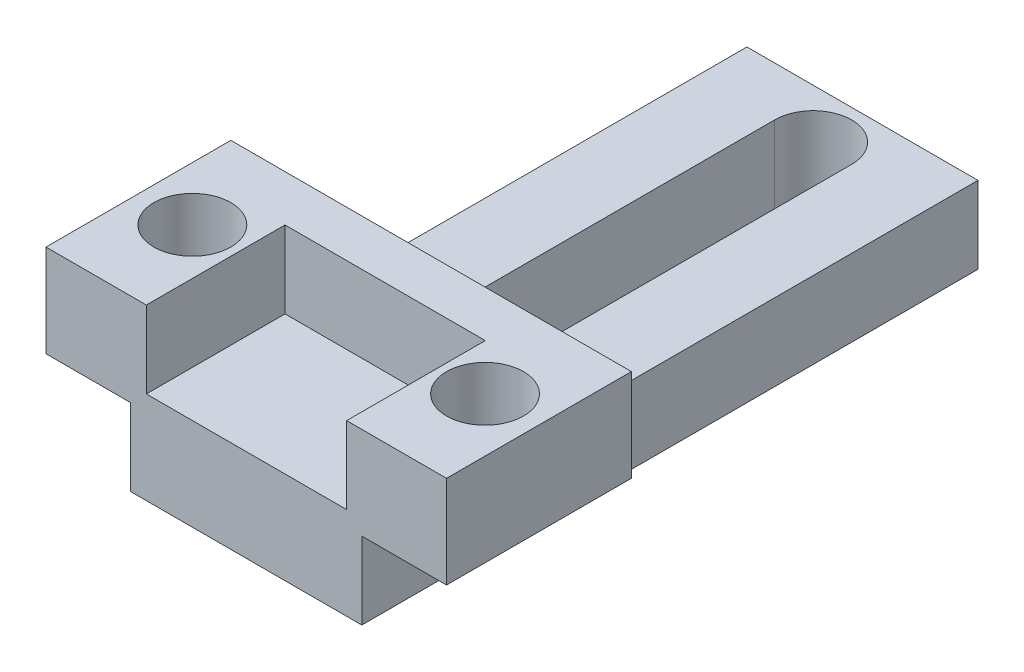
from build123d import *

# Parameters (mm, degrees)
SKETCH_1_W          = 15
SKETCH_1_H          = 40
EXTRUDE_1_DEPTH     = 5
SKETCH_2_W          = 26
SKETCH_2_H          = 12
SKETCH_2_R          = 2.5
EXTRUDE_2_DEPTH     = 6
SKETCH_3_W          = 13
SKETCH_3_H          = 9
CUT_EXTRUDE_1_DEPTH = 5


with BuildPart() as part:
    # 草圖1 → 填料-伸長1 (new body)
    with BuildSketch(Plane(origin=(0, 0, 0), x_dir=(1, 0, 0), z_dir=(0, 1, 0))):
        Rectangle(SKETCH_1_W, SKETCH_1_H)
        with BuildLine():
            Line((2.5, 16.799309419), (2.5, -11.700690581))
            ThreePointArc((2.5, -11.700690581), (0, -14.200690581), (-2.5, -11.700690581))
            Line((-2.5, -11.700690581), (-2.5, 16.799309419))
            ThreePointArc((-2.5, 16.799309419), (0, 19.299309419), (2.5, 16.799309419))
        make_face(mode=Mode.SUBTRACT)
    extrude(amount=EXTRUDE_1_DEPTH)

    # 草圖2 → 填料-伸長2 (add)
    with BuildSketch(Plane(origin=(0, 5, 0), x_dir=(1, 0, 0), z_dir=(0, 1, 0))):
        with Locations((0, -14)):
            Rectangle(SKETCH_2_W, SKETCH_2_H)
        with Locations(Location((-9.5, -14, 0), (0, 0, 36.869897646))):
            Circle(SKETCH_2_R, mode=Mode.SUBTRACT)
        with Locations(Location((9.5, -14, 0), (0, 0, 90))):
            Circle(SKETCH_2_R, mode=Mode.SUBTRACT)
    extrude(amount=EXTRUDE_2_DEPTH)

    # 草圖3 → 除料-伸長1 (cut)
    with BuildSketch(Plane(origin=(0, 11, 0), x_dir=(1, 0, 0), z_dir=(0, 1, 0))):
        with Locations((0.015491802, -15.5)):
            Rectangle(SKETCH_3_W, SKETCH_3_H)
    extrude(amount=-CUT_EXTRUDE_1_DEPTH, mode=Mode.SUBTRACT)


solid = part.part
